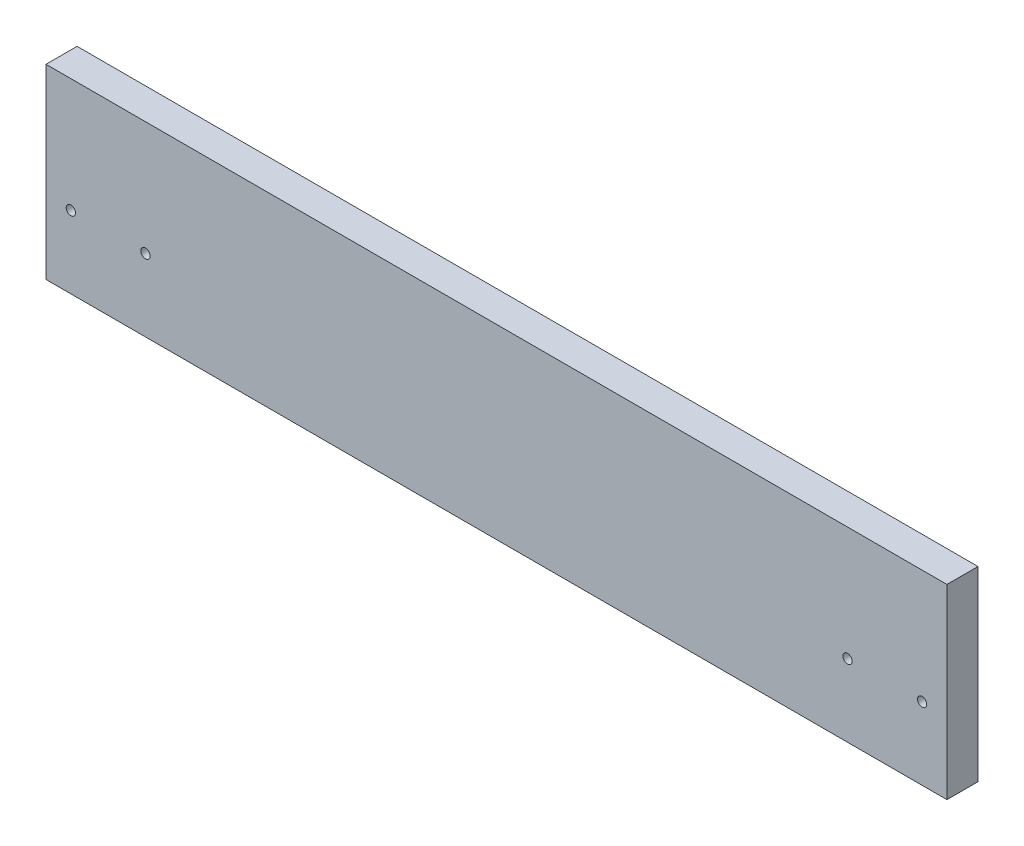
from build123d import *

# Parameters (mm, degrees)
SKETCH_1_W          = 290
SKETCH_1_H          = 60
EXTRUDE_333_DEPTH   = 10
SKETCH_3_R          = 1.5
CUT_EXTRUDE_1_DEPTH = 297.310647801


with BuildPart() as part:
    # Эскиз1 → Extrude 333 (new body)
    with BuildSketch(Plane.XY):
        with Locations((145, 30)):
            Rectangle(SKETCH_1_W, SKETCH_1_H)
    extrude(amount=EXTRUDE_333_DEPTH)

    # Эскиз3 → Вырез-Вытянуть1 (cut, through all)
    with BuildSketch(Plane.XY.offset(10)):
        with Locations((8, 23.291028808)):
            Circle(SKETCH_3_R)
        with Locations(Location((32, 23.291028808, 0), (0, 0, 180))):
            Circle(SKETCH_3_R)
        with Locations(Location((282, 23.291028808, 0), (0, 0, 180))):
            Circle(SKETCH_3_R)
        with Locations((258, 23.291028808)):
            Circle(SKETCH_3_R)
    extrude(amount=-CUT_EXTRUDE_1_DEPTH, mode=Mode.SUBTRACT)


solid = part.part
